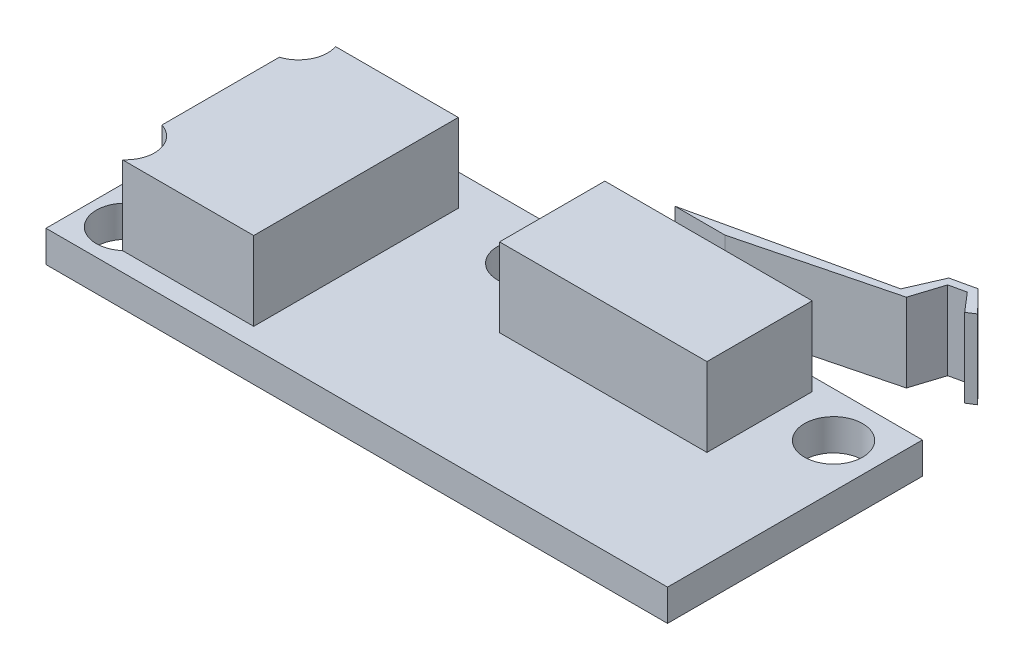
from build123d import *

# Parameters (mm, degrees)
SKETCH1_W           = 39.5
SKETCH1_H           = 16.2
SKETCH1_R           = 1.85
BOSS_EXTRUDE1_DEPTH = 2
SKETCH3_W           = 13.178872399
SKETCH3_H           = 6.690552867
BOSS_EXTRUDE2_DEPTH = 5


with BuildPart() as part:
    # Sketch1 → Boss-Extrude1 (new body)
    with BuildSketch(Plane(origin=(0, 0, 0), x_dir=(1, 0, 0), z_dir=(0, 1, 0))):
        with Locations((19.75, 8.1)):
            Rectangle(SKETCH1_W, SKETCH1_H)
        with Locations(Location((2.45, 2.6, 0), (0, 0, 270))):
            Circle(SKETCH1_R, mode=Mode.SUBTRACT)
        with Locations(Location((2.45, 13.6, 0), (0, 0, 270))):
            Circle(SKETCH1_R, mode=Mode.SUBTRACT)
        with Locations(Location((17.2, 13.35, 0), (0, 0, 270))):
            Circle(SKETCH1_R, mode=Mode.SUBTRACT)
        with Locations(Location((36.7, 13.35, 0), (0, 0, 270))):
            Circle(SKETCH1_R, mode=Mode.SUBTRACT)
    extrude(amount=BOSS_EXTRUDE1_DEPTH)

    # Sketch3 → Boss-Extrude2 (add)
    with BuildSketch(Plane(origin=(0, 2, 0), x_dir=(1, 0, 0), z_dir=(0, 1, 0))):
        Polygon((35.497687692, 18.825256707), (23.773240265, 16.2), (26.946450249, 16.2), (36.134464305, 18.547298661), (36.765687587, 20.534044166), (37.789665501, 20.763326177), (38.817684959, 19.566778939), (39.323268299, 19.886981721), (37.942468273, 21.288579371), (36.424590482, 20.948706735), align=None)
        with Locations((26.751095909, 12.008308005)):
            Rectangle(SKETCH3_W, SKETCH3_H)
        with BuildLine():
            Line((12, 14.2), (4.2, 14.2))
            ThreePointArc((4.2, 14.2), (4.099971409, 12.763283592), (3, 11.833647827))
            Line((3, 11.833647827), (3, 4.366352173))
            ThreePointArc((3, 4.366352173), (4.261150091, 2.977141017), (3.659338662, 1.2))
            Line((3.659338662, 1.2), (12, 1.2))
            Line((12, 1.2), (12, 14.2))
        make_face()
    extrude(amount=BOSS_EXTRUDE2_DEPTH)


with BuildPart() as boss_extrude2_piece_1:
    # of the separate pieces the step leaves, piece 1, a body of its own (boss_extrude2_pieces)
    add(part.part.solids().sort_by_distance((0, 0, 0))[0])


with BuildPart() as boss_extrude2_piece_2:
    # of the separate pieces the step leaves, piece 2, a body of its own (boss_extrude2_pieces)
    add(part.part.solids().sort_by_distance((36.424590482, 2, -20.948706735))[0])


solid = Compound([boss_extrude2_piece_1.part, boss_extrude2_piece_2.part])
